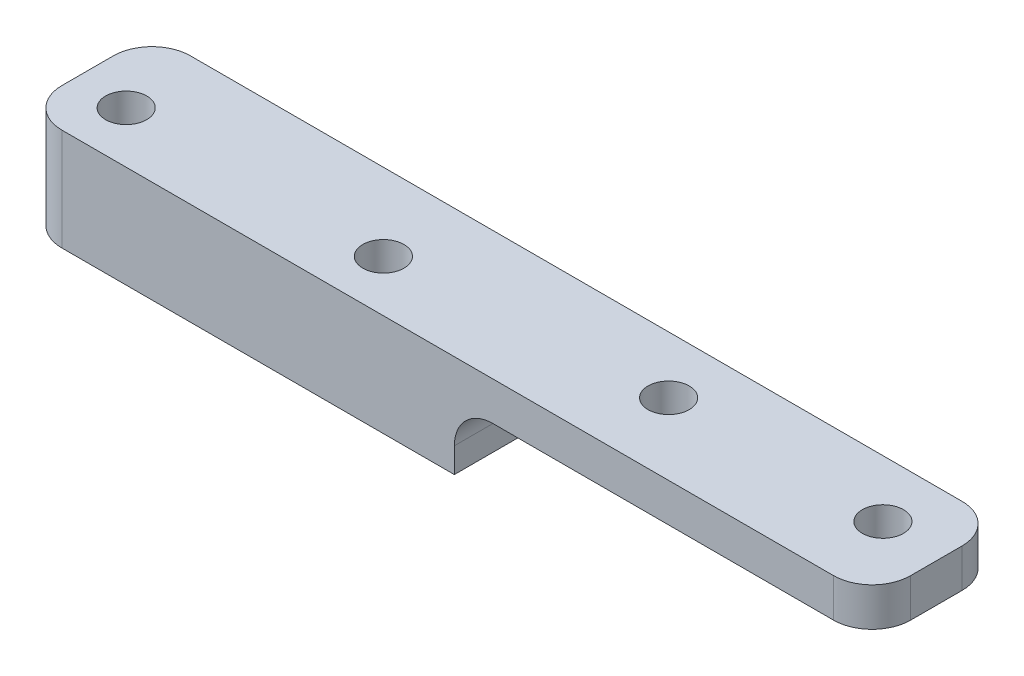
from build123d import *
from build123d.topology import SkipClean

# Parameters (mm, degrees)
SKETCH1_W           = 66
SKETCH1_H           = 10
SKETCH1_R           = 1.6
BOSS_EXTRUDE1_DEPTH = 3
BOSS_EXTRUDE2_START = 4.94
SKETCH3_W           = 33.517476949
SKETCH3_H           = 10
SKETCH3_R           = 1.6
BOSS_EXTRUDE2_DEPTH = 4.94
FILLET1_R           = 3


with BuildPart() as part:
    # Sketch1 → Boss-Extrude1 (new body)
    with BuildSketch(Plane(origin=(0, 0, 0), x_dir=(1, 0, 0), z_dir=(0, 1, 0))):
        with Locations((29, 1)):
            Rectangle(SKETCH1_W, SKETCH1_H)
        with Locations(Location((0, 0, 0), (0, 0, 270))):
            Circle(SKETCH1_R, mode=Mode.SUBTRACT)
        with Locations(Location((20, 0, 0), (0, 0, 270))):
            Circle(SKETCH1_R, mode=Mode.SUBTRACT)
        with Locations(Location((40.615756989, 1.563218196, 0), (0, 0, 270))):
            Circle(SKETCH1_R, mode=Mode.SUBTRACT)
        with Locations(Location((57.278038862, 1.563218196, 0), (0, 0, 270))):
            Circle(SKETCH1_R, mode=Mode.SUBTRACT)
    extrude(amount=BOSS_EXTRUDE1_DEPTH)

    # Sketch3 → Boss-Extrude2 (add)
    with SkipClean():  # the faces are left unmerged after this step: merging them gives an invalid solid
        with BuildSketch(Plane.XZ.offset(BOSS_EXTRUDE2_START)):
            with Locations((12.758738475, -1)):
                Rectangle(SKETCH3_W, SKETCH3_H)
            with Locations(Location((0, 0, 0), (0, 0, 270))):
                Circle(SKETCH3_R, mode=Mode.SUBTRACT)
            with Locations(Location((20, 0, 0), (0, 0, 270))):
                Circle(SKETCH3_R, mode=Mode.SUBTRACT)
        extrude(amount=-BOSS_EXTRUDE2_DEPTH)

    # Fillet1
    fillet1_edges = [part.edges().sort_by_distance(p)[0] for p in [
        (29.517476949, 0, -1),
        (-4, -2.47, -6),
        (62, 1.5, -6),
        (62, 1.5, 4),
        (-4, -2.47, 4),
    ]]
    fillet(fillet1_edges, radius=FILLET1_R)


solid = part.part
